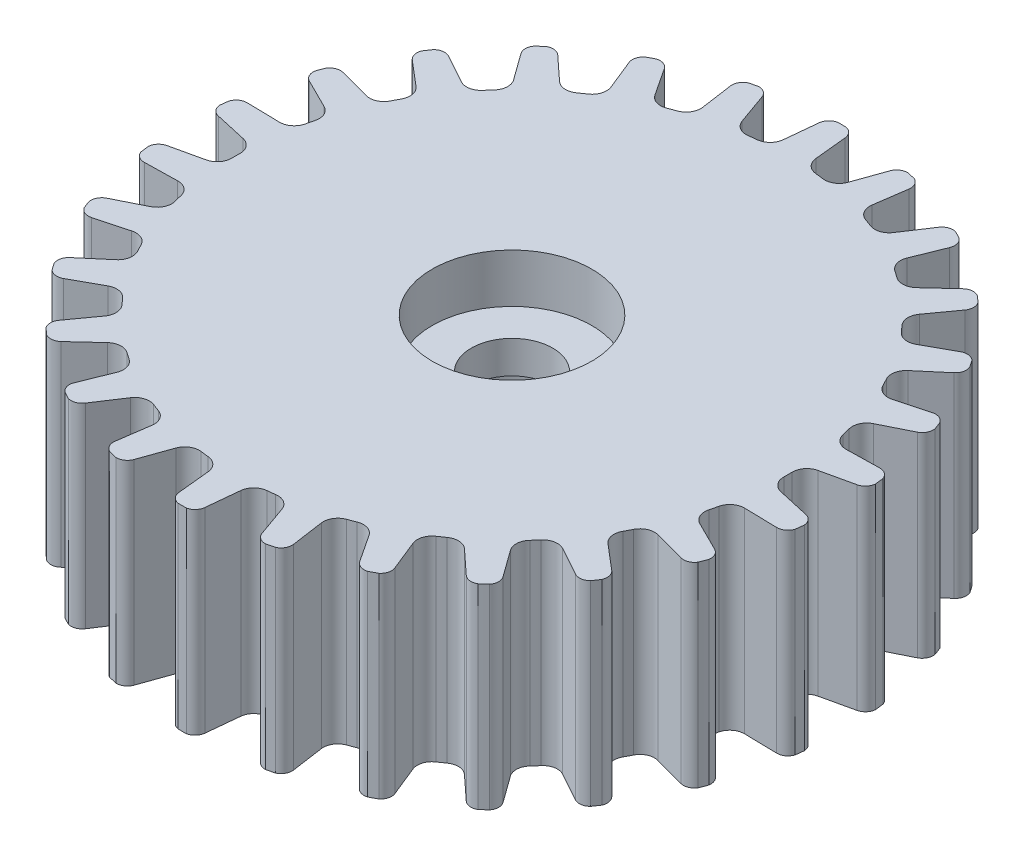
from build123d import *

# Parameters (mm, degrees)
SKETCH1_R           = 10.125
SKETCH1_R_2         = 2.45
BOSS_EXTRUDE1_DEPTH = 6
CUT_EXTRUDE1_START  = -6
SKETCH2_R           = 11.178148921
CUT_EXTRUDE1_DEPTH  = 6
BOSS_EXTRUDE2_START = -2.5
SKETCH3_R           = 2.45
SKETCH3_R_2         = 1.25
BOSS_EXTRUDE2_DEPTH = 2.5
CUT_EXTRUDE2_START  = -1.5
SKETCH4_R           = 2.45
CUT_EXTRUDE2_DEPTH  = 1.5


with BuildPart() as part:
    # Sketch1 → Boss-Extrude1 (new body)
    with BuildSketch(Plane(origin=(0, 0, 0), x_dir=(1, 0, 0), z_dir=(0, 1, 0))):
        with Locations(Location((0, 0, 0), (0, 0, 270))):
            Circle(SKETCH1_R)
        with Locations(Location((0, 0, 0), (0, 0, 270))):
            Circle(SKETCH1_R_2, mode=Mode.SUBTRACT)
    extrude(amount=BOSS_EXTRUDE1_DEPTH)

    # Sketch2 → Cut-Extrude1 (cut)
    with BuildSketch(Plane(origin=(0, 6, 0), x_dir=(1, 0, 0), z_dir=(0, 1, 0)).offset(CUT_EXTRUDE1_START)):
        Circle(SKETCH2_R)
        with BuildLine():
            Line((0.5, 8.825), (0.4, 9.825))
            ThreePointArc((0.4, 9.825), (0.265875857, 10.062834476), (0, 10.125))
            ThreePointArc((0, 10.125), (-0.265875857, 10.062834476), (-0.4, 9.825))
            Line((-0.4, 9.825), (-0.5, 8.825))
            ThreePointArc((-0.5, 8.825), (-0.628607324, 8.553607324), (-0.9, 8.425))
            ThreePointArc((-0.9, 8.425), (-1.021299439, 8.411157617), (-1.142386836, 8.39556891))
            ThreePointArc((-1.142386836, 8.39556891), (-1.436671081, 8.45549062), (-1.626489829, 8.688219371))
            Line((-1.626489829, 8.688219371), (-1.962899675, 9.635229622))
            ThreePointArc((-1.962899675, 9.635229622), (-2.150043929, 9.834055052), (-2.423071101, 9.830785901))
            ThreePointArc((-2.423071101, 9.830785901), (-2.666343905, 9.706798537), (-2.739653129, 9.44377709))
            Line((-2.739653129, 9.44377709), (-2.597431646, 8.448903707))
            ThreePointArc((-2.597431646, 8.448903707), (-2.657353357, 8.154619462), (-2.890082107, 7.964800714))
            ThreePointArc((-2.890082107, 7.964800714), (-3.004544106, 7.922331709), (-3.118382301, 7.878217871))
            ThreePointArc((-3.118382301, 7.878217871), (-3.418455385, 7.865971536), (-3.65845398, 8.046511012))
            Line((-3.65845398, 8.046511012), (-4.211722755, 8.885494721))
            ThreePointArc((-4.211722755, 8.885494721), (-4.441010978, 9.033756094), (-4.705322117, 8.96524226))
            ThreePointArc((-4.705322117, 8.96524226), (-4.911853737, 8.78663875), (-4.920087576, 8.513716183))
            Line((-4.920087576, 8.513716183), (-4.543910006, 7.58178784))
            ThreePointArc((-4.543910006, 7.58178784), (-4.531663671, 7.281714757), (-4.712203148, 7.041716161))
            ThreePointArc((-4.712203148, 7.041716161), (-4.813175591, 6.97308868), (-4.913148722, 6.903013446))
            ThreePointArc((-4.913148722, 6.903013446), (-5.201571488, 6.819310778), (-5.477802085, 6.937168682))
            Line((-5.477802085, 6.937168682), (-6.215775818, 7.619367164))
            ThreePointArc((-6.215775818, 7.619367164), (-6.473882611, 7.708448068), (-6.714116915, 7.578671325))
            ThreePointArc((-6.714116915, 7.578671325), (-6.871904484, 7.355831457), (-6.814584416, 7.088869037))
            Line((-6.814584416, 7.088869037), (-6.226312833, 6.274046023))
            ThreePointArc((-6.226312833, 6.274046023), (-6.142610165, 5.985623258), (-6.260468069, 5.709392661))
            ThreePointArc((-6.260468069, 5.709392661), (-6.342082805, 5.618595082), (-6.422380798, 5.526630971))
            ThreePointArc((-6.422380798, 5.526630971), (-6.682391163, 5.376336464), (-6.978800243, 5.424663323))
            Line((-6.978800243, 5.424663323), (-7.858590584, 5.910429683))
            ThreePointArc((-7.858590584, 5.910429683), (-8.130515718, 5.935153059), (-8.332711642, 5.751655561))
            ThreePointArc((-8.332711642, 5.751655561), (-8.432585121, 5.497529977), (-8.313042381, 5.25204259))
            Line((-8.313042381, 5.25204259), (-7.54686499, 4.601679457))
            ThreePointArc((-7.54686499, 4.601679457), (-7.396570484, 4.341669092), (-7.444897342, 4.045260012))
            ThreePointArc((-7.444897342, 4.045260012), (-7.502411219, 3.937569161), (-7.558367446, 3.829060792))
            ThreePointArc((-7.558367446, 3.829060792), (-7.774854553, 3.620909018), (-8.074215898, 3.596896249))
            Line((-8.074215898, 3.596896249), (-9.04469263, 3.857999512))
            ThreePointArc((-9.04469263, 3.857999512), (-9.314632804, 3.816928528), (-9.467039457, 3.590374481))
            ThreePointArc((-9.467039457, 3.590374481), (-9.503194561, 3.319732038), (-9.328376539, 3.109986518))
            Line((-9.328376539, 3.109986518), (-8.428820785, 2.661880007))
            ThreePointArc((-8.428820785, 2.661880007), (-8.220669011, 2.445392901), (-8.196656243, 2.146031555))
            ThreePointArc((-8.196656243, 2.146031555), (-8.226726764, 2.027706032), (-8.255089252, 1.908959518))
            ThreePointArc((-8.255089252, 1.908959518), (-8.415471656, 1.6550475), (-8.700387474, 1.56009064))
            Line((-8.700387474, 1.56009064), (-9.705150016, 1.581356433))
            ThreePointArc((-9.705150016, 1.581356433), (-9.95741729, 1.476877985), (-10.05117735, 1.220433888))
            ThreePointArc((-10.05117735, 1.220433888), (-10.021512876, 0.949003339), (-9.80157936, 0.787189334))
            Line((-9.80157936, 0.787189334), (-8.820924154, 0.567381766))
            ThreePointArc((-8.820924154, 0.567381766), (-8.567012137, 0.406999362), (-8.472055277, 0.122083544))
            ThreePointArc((-8.472055277, 0.122083544), (-8.472934852, 0), (-8.472055277, -0.122083544))
            ThreePointArc((-8.472055277, -0.122083544), (-8.567012137, -0.406999362), (-8.820924154, -0.567381766))
            Line((-8.820924154, -0.567381766), (-9.80157936, -0.787189334))
            ThreePointArc((-9.80157936, -0.787189334), (-10.021512876, -0.949003339), (-10.05117735, -1.220433888))
            ThreePointArc((-10.05117735, -1.220433888), (-9.95741729, -1.476877985), (-9.705150016, -1.581356433))
            Line((-9.705150016, -1.581356433), (-8.700387474, -1.56009064))
            ThreePointArc((-8.700387474, -1.56009064), (-8.415471656, -1.6550475), (-8.255089252, -1.908959518))
            ThreePointArc((-8.255089252, -1.908959518), (-8.226726764, -2.027706032), (-8.196656243, -2.146031555))
            ThreePointArc((-8.196656243, -2.146031555), (-8.220669011, -2.445392901), (-8.428820785, -2.661880007))
            Line((-8.428820785, -2.661880007), (-9.328376539, -3.109986518))
            ThreePointArc((-9.328376539, -3.109986518), (-9.503194561, -3.319732038), (-9.467039457, -3.590374481))
            ThreePointArc((-9.467039457, -3.590374481), (-9.314632804, -3.816928528), (-9.04469263, -3.857999512))
            Line((-9.04469263, -3.857999512), (-8.074215898, -3.596896249))
            ThreePointArc((-8.074215898, -3.596896249), (-7.774854553, -3.620909018), (-7.558367446, -3.829060792))
            ThreePointArc((-7.558367446, -3.829060792), (-7.502411219, -3.937569161), (-7.444897342, -4.045260012))
            ThreePointArc((-7.444897342, -4.045260012), (-7.396570484, -4.341669092), (-7.54686499, -4.601679457))
            Line((-7.54686499, -4.601679457), (-8.313042381, -5.25204259))
            ThreePointArc((-8.313042381, -5.25204259), (-8.432585121, -5.497529977), (-8.332711642, -5.751655561))
            ThreePointArc((-8.332711642, -5.751655561), (-8.130515718, -5.935153059), (-7.858590584, -5.910429683))
            Line((-7.858590584, -5.910429683), (-6.978800243, -5.424663323))
            ThreePointArc((-6.978800243, -5.424663323), (-6.682391163, -5.376336464), (-6.422380798, -5.526630971))
            ThreePointArc((-6.422380798, -5.526630971), (-6.342082805, -5.618595082), (-6.260468069, -5.709392661))
            ThreePointArc((-6.260468069, -5.709392661), (-6.142610165, -5.985623258), (-6.226312833, -6.274046023))
            Line((-6.226312833, -6.274046023), (-6.814584416, -7.088869037))
            ThreePointArc((-6.814584416, -7.088869037), (-6.871904484, -7.355831457), (-6.714116915, -7.578671325))
            ThreePointArc((-6.714116915, -7.578671325), (-6.473882611, -7.708448068), (-6.215775818, -7.619367164))
            Line((-6.215775818, -7.619367164), (-5.477802085, -6.937168682))
            ThreePointArc((-5.477802085, -6.937168682), (-5.201571488, -6.819310778), (-4.913148722, -6.903013446))
            ThreePointArc((-4.913148722, -6.903013446), (-4.813175591, -6.97308868), (-4.712203148, -7.041716161))
            ThreePointArc((-4.712203148, -7.041716161), (-4.531663671, -7.281714757), (-4.543910006, -7.58178784))
            Line((-4.543910006, -7.58178784), (-4.920087576, -8.513716183))
            ThreePointArc((-4.920087576, -8.513716183), (-4.911853737, -8.78663875), (-4.705322117, -8.96524226))
            ThreePointArc((-4.705322117, -8.96524226), (-4.441010978, -9.033756094), (-4.211722755, -8.885494721))
            Line((-4.211722755, -8.885494721), (-3.65845398, -8.046511012))
            ThreePointArc((-3.65845398, -8.046511012), (-3.418455385, -7.865971536), (-3.118382301, -7.878217871))
            ThreePointArc((-3.118382301, -7.878217871), (-3.004544106, -7.922331709), (-2.890082107, -7.964800714))
            ThreePointArc((-2.890082107, -7.964800714), (-2.657353357, -8.154619462), (-2.597431646, -8.448903707))
            Line((-2.597431646, -8.448903707), (-2.739653129, -9.44377709))
            ThreePointArc((-2.739653129, -9.44377709), (-2.666343905, -9.706798537), (-2.423071101, -9.830785901))
            ThreePointArc((-2.423071101, -9.830785901), (-2.150043929, -9.834055052), (-1.962899675, -9.635229622))
            Line((-1.962899675, -9.635229622), (-1.626489829, -8.688219371))
            ThreePointArc((-1.626489829, -8.688219371), (-1.436671081, -8.45549062), (-1.142386836, -8.39556891))
            ThreePointArc((-1.142386836, -8.39556891), (-1.021299439, -8.411157617), (-0.9, -8.425))
            ThreePointArc((-0.9, -8.425), (-0.628607324, -8.553607324), (-0.5, -8.825))
            Line((-0.5, -8.825), (-0.4, -9.825))
            ThreePointArc((-0.4, -9.825), (-0.265875857, -10.062834476), (0, -10.125))
            ThreePointArc((0, -10.125), (0.265875857, -10.062834476), (0.4, -9.825))
            Line((0.4, -9.825), (0.5, -8.825))
            ThreePointArc((0.5, -8.825), (0.628607324, -8.553607324), (0.9, -8.425))
            ThreePointArc((0.9, -8.425), (1.021299439, -8.411157617), (1.142386836, -8.39556891))
            ThreePointArc((1.142386836, -8.39556891), (1.436671081, -8.45549062), (1.626489829, -8.688219371))
            Line((1.626489829, -8.688219371), (1.962899675, -9.635229622))
            ThreePointArc((1.962899675, -9.635229622), (2.150043929, -9.834055052), (2.423071101, -9.830785901))
            ThreePointArc((2.423071101, -9.830785901), (2.666343905, -9.706798537), (2.739653129, -9.44377709))
            Line((2.739653129, -9.44377709), (2.597431646, -8.448903707))
            ThreePointArc((2.597431646, -8.448903707), (2.657353357, -8.154619462), (2.890082107, -7.964800714))
            ThreePointArc((2.890082107, -7.964800714), (3.004544106, -7.922331709), (3.118382301, -7.878217871))
            ThreePointArc((3.118382301, -7.878217871), (3.418455385, -7.865971536), (3.65845398, -8.046511012))
            Line((3.65845398, -8.046511012), (4.211722755, -8.885494721))
            ThreePointArc((4.211722755, -8.885494721), (4.441010978, -9.033756094), (4.705322117, -8.96524226))
            ThreePointArc((4.705322117, -8.96524226), (4.911853737, -8.78663875), (4.920087576, -8.513716183))
            Line((4.920087576, -8.513716183), (4.543910006, -7.58178784))
            ThreePointArc((4.543910006, -7.58178784), (4.531663671, -7.281714757), (4.712203148, -7.041716161))
            ThreePointArc((4.712203148, -7.041716161), (4.813175591, -6.97308868), (4.913148722, -6.903013446))
            ThreePointArc((4.913148722, -6.903013446), (5.201571488, -6.819310778), (5.477802085, -6.937168682))
            Line((5.477802085, -6.937168682), (6.215775818, -7.619367164))
            ThreePointArc((6.215775818, -7.619367164), (6.473882611, -7.708448068), (6.714116915, -7.578671325))
            ThreePointArc((6.714116915, -7.578671325), (6.871904484, -7.355831457), (6.814584416, -7.088869037))
            Line((6.814584416, -7.088869037), (6.226312833, -6.274046023))
            ThreePointArc((6.226312833, -6.274046023), (6.142610165, -5.985623258), (6.260468069, -5.709392661))
            ThreePointArc((6.260468069, -5.709392661), (6.342082805, -5.618595082), (6.422380798, -5.526630971))
            ThreePointArc((6.422380798, -5.526630971), (6.682391163, -5.376336464), (6.978800243, -5.424663323))
            Line((6.978800243, -5.424663323), (7.858590584, -5.910429683))
            ThreePointArc((7.858590584, -5.910429683), (8.130515718, -5.935153059), (8.332711642, -5.751655561))
            ThreePointArc((8.332711642, -5.751655561), (8.432585121, -5.497529977), (8.313042381, -5.25204259))
            Line((8.313042381, -5.25204259), (7.54686499, -4.601679457))
            ThreePointArc((7.54686499, -4.601679457), (7.396570484, -4.341669092), (7.444897342, -4.045260012))
            ThreePointArc((7.444897342, -4.045260012), (7.502411219, -3.937569161), (7.558367446, -3.829060792))
            ThreePointArc((7.558367446, -3.829060792), (7.774854553, -3.620909018), (8.074215898, -3.596896249))
            Line((8.074215898, -3.596896249), (9.04469263, -3.857999512))
            ThreePointArc((9.04469263, -3.857999512), (9.314632804, -3.816928528), (9.467039457, -3.590374481))
            ThreePointArc((9.467039457, -3.590374481), (9.503194561, -3.319732038), (9.328376539, -3.109986518))
            Line((9.328376539, -3.109986518), (8.428820785, -2.661880007))
            ThreePointArc((8.428820785, -2.661880007), (8.220669011, -2.445392901), (8.196656243, -2.146031555))
            ThreePointArc((8.196656243, -2.146031555), (8.226726764, -2.027706032), (8.255089252, -1.908959518))
            ThreePointArc((8.255089252, -1.908959518), (8.415471656, -1.6550475), (8.700387474, -1.56009064))
            Line((8.700387474, -1.56009064), (9.705150016, -1.581356433))
            ThreePointArc((9.705150016, -1.581356433), (9.95741729, -1.476877985), (10.05117735, -1.220433888))
            ThreePointArc((10.05117735, -1.220433888), (10.021512876, -0.949003339), (9.80157936, -0.787189334))
            Line((9.80157936, -0.787189334), (8.820924154, -0.567381766))
            ThreePointArc((8.820924154, -0.567381766), (8.567012137, -0.406999362), (8.472055277, -0.122083544))
            ThreePointArc((8.472055277, -0.122083544), (8.472934852, 0), (8.472055277, 0.122083544))
            ThreePointArc((8.472055277, 0.122083544), (8.567012137, 0.406999362), (8.820924154, 0.567381766))
            Line((8.820924154, 0.567381766), (9.80157936, 0.787189334))
            ThreePointArc((9.80157936, 0.787189334), (10.021512876, 0.949003339), (10.05117735, 1.220433888))
            ThreePointArc((10.05117735, 1.220433888), (9.95741729, 1.476877985), (9.705150016, 1.581356433))
            Line((9.705150016, 1.581356433), (8.700387474, 1.56009064))
            ThreePointArc((8.700387474, 1.56009064), (8.415471656, 1.6550475), (8.255089252, 1.908959518))
            ThreePointArc((8.255089252, 1.908959518), (8.226726764, 2.027706032), (8.196656243, 2.146031555))
            ThreePointArc((8.196656243, 2.146031555), (8.220669011, 2.445392901), (8.428820785, 2.661880007))
            Line((8.428820785, 2.661880007), (9.328376539, 3.109986518))
            ThreePointArc((9.328376539, 3.109986518), (9.503194561, 3.319732038), (9.467039457, 3.590374481))
            ThreePointArc((9.467039457, 3.590374481), (9.314632804, 3.816928528), (9.04469263, 3.857999512))
            Line((9.04469263, 3.857999512), (8.074215898, 3.596896249))
            ThreePointArc((8.074215898, 3.596896249), (7.774854553, 3.620909018), (7.558367446, 3.829060792))
            ThreePointArc((7.558367446, 3.829060792), (7.502411219, 3.937569161), (7.444897342, 4.045260012))
            ThreePointArc((7.444897342, 4.045260012), (7.396570484, 4.341669092), (7.54686499, 4.601679457))
            Line((7.54686499, 4.601679457), (8.313042381, 5.25204259))
            ThreePointArc((8.313042381, 5.25204259), (8.432585121, 5.497529977), (8.332711642, 5.751655561))
            ThreePointArc((8.332711642, 5.751655561), (8.130515718, 5.935153059), (7.858590584, 5.910429683))
            Line((7.858590584, 5.910429683), (6.978800243, 5.424663323))
            ThreePointArc((6.978800243, 5.424663323), (6.682391163, 5.376336464), (6.422380798, 5.526630971))
            ThreePointArc((6.422380798, 5.526630971), (6.342082805, 5.618595082), (6.260468069, 5.709392661))
            ThreePointArc((6.260468069, 5.709392661), (6.142610165, 5.985623258), (6.226312833, 6.274046023))
            Line((6.226312833, 6.274046023), (6.814584416, 7.088869037))
            ThreePointArc((6.814584416, 7.088869037), (6.871904484, 7.355831457), (6.714116915, 7.578671325))
            ThreePointArc((6.714116915, 7.578671325), (6.473882611, 7.708448068), (6.215775818, 7.619367164))
            Line((6.215775818, 7.619367164), (5.477802085, 6.937168682))
            ThreePointArc((5.477802085, 6.937168682), (5.201571488, 6.819310778), (4.913148722, 6.903013446))
            ThreePointArc((4.913148722, 6.903013446), (4.813175591, 6.97308868), (4.712203148, 7.041716161))
            ThreePointArc((4.712203148, 7.041716161), (4.531663671, 7.281714757), (4.543910006, 7.58178784))
            Line((4.543910006, 7.58178784), (4.920087576, 8.513716183))
            ThreePointArc((4.920087576, 8.513716183), (4.911853737, 8.78663875), (4.705322117, 8.96524226))
            ThreePointArc((4.705322117, 8.96524226), (4.441010978, 9.033756094), (4.211722755, 8.885494721))
            Line((4.211722755, 8.885494721), (3.65845398, 8.046511012))
            ThreePointArc((3.65845398, 8.046511012), (3.418455385, 7.865971536), (3.118382301, 7.878217871))
            ThreePointArc((3.118382301, 7.878217871), (3.004544106, 7.922331709), (2.890082107, 7.964800714))
            ThreePointArc((2.890082107, 7.964800714), (2.657353357, 8.154619462), (2.597431646, 8.448903707))
            Line((2.597431646, 8.448903707), (2.739653129, 9.44377709))
            ThreePointArc((2.739653129, 9.44377709), (2.666343905, 9.706798537), (2.423071101, 9.830785901))
            ThreePointArc((2.423071101, 9.830785901), (2.150043929, 9.834055052), (1.962899675, 9.635229622))
            Line((1.962899675, 9.635229622), (1.626489829, 8.688219371))
            ThreePointArc((1.626489829, 8.688219371), (1.436671081, 8.45549062), (1.142386836, 8.39556891))
            ThreePointArc((1.142386836, 8.39556891), (1.021299439, 8.411157617), (0.9, 8.425))
            ThreePointArc((0.9, 8.425), (0.628607324, 8.553607324), (0.5, 8.825))
        make_face(mode=Mode.SUBTRACT)
    extrude(amount=CUT_EXTRUDE1_DEPTH, mode=Mode.SUBTRACT)

    # Sketch3 → Boss-Extrude2 (add)
    with BuildSketch(Plane(origin=(0, 6, 0), x_dir=(1, 0, 0), z_dir=(0, 1, 0)).offset(BOSS_EXTRUDE2_START)):
        with Locations(Location((0, 0, 0), (0, 0, 270))):
            Circle(SKETCH3_R)
        with Locations(Location((0, 0, 0), (0, 0, 270))):
            Circle(SKETCH3_R_2, mode=Mode.SUBTRACT)
    extrude(amount=BOSS_EXTRUDE2_DEPTH)

    # Sketch4 → Cut-Extrude2 (cut)
    with BuildSketch(Plane(origin=(0, 6, 0), x_dir=(1, 0, 0), z_dir=(0, 1, 0)).offset(CUT_EXTRUDE2_START)):
        with Locations(Location((0, 0, 0), (0, 0, 270))):
            Circle(SKETCH4_R)
    extrude(amount=CUT_EXTRUDE2_DEPTH, mode=Mode.SUBTRACT)


solid = part.part
